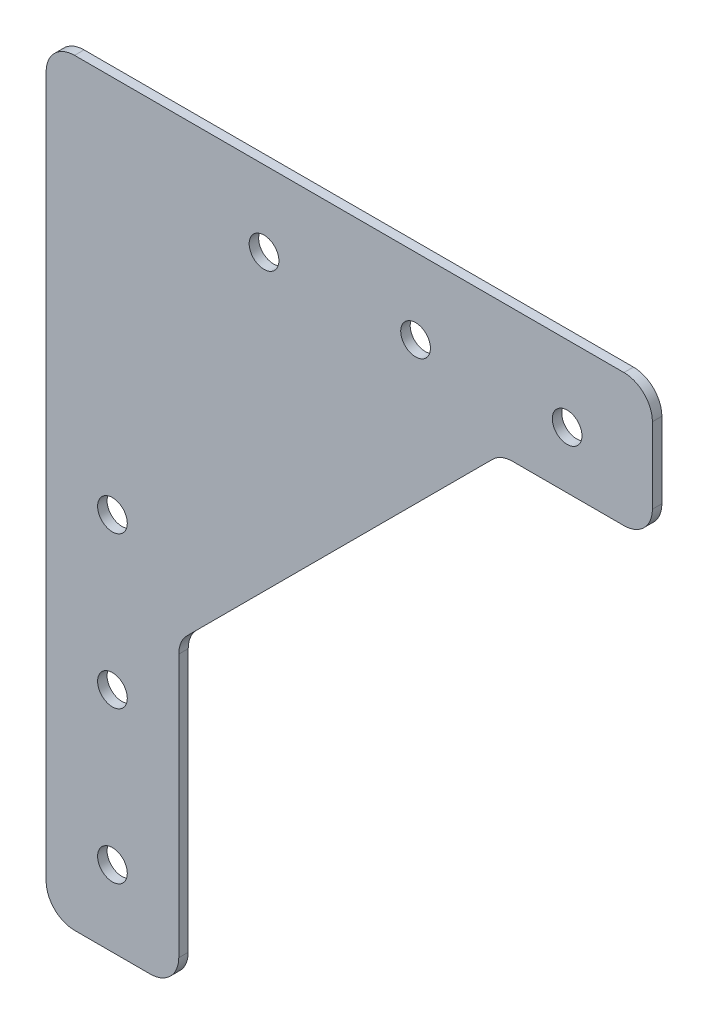
from build123d import *

# Parameters (mm, degrees)
SKETCH1_R           = 2.4892
BOSS_EXTRUDE1_DEPTH = 0.79375
FILLET1_R           = 4.7625


with BuildPart() as part:
    # Sketch1 → Boss-Extrude1 (new, symmetric)
    with BuildSketch(Plane.XY):
        Polygon((0, 0), (0, 127), (101.6, 127), (101.6, 104.775), (76.2, 104.775), (22.225, 50.8), (22.225, 0), align=None)
        with Locations((11.1125, 63.5)):
            Circle(SKETCH1_R, mode=Mode.SUBTRACT)
        with Locations((11.1125, 38.1)):
            Circle(SKETCH1_R, mode=Mode.SUBTRACT)
        with Locations((11.1125, 12.7)):
            Circle(SKETCH1_R, mode=Mode.SUBTRACT)
        with Locations((87.3125, 114.3)):
            Circle(SKETCH1_R, mode=Mode.SUBTRACT)
        with Locations((61.9125, 114.3)):
            Circle(SKETCH1_R, mode=Mode.SUBTRACT)
        with Locations((36.5125, 114.3)):
            Circle(SKETCH1_R, mode=Mode.SUBTRACT)
    extrude(amount=BOSS_EXTRUDE1_DEPTH, both=True)

    # Fillet1
    fillet1_edges = [part.edges().sort_by_distance(p)[0] for p in [
        (22.225, 0, 0),
        (22.225, 50.8, 0),
        (76.2, 104.775, 0),
        (101.6, 104.775, 0),
        (101.6, 127, 0),
        (0, 127, 0),
        (0, 0, 0),
    ]]
    fillet(fillet1_edges, radius=FILLET1_R)


solid = part.part
